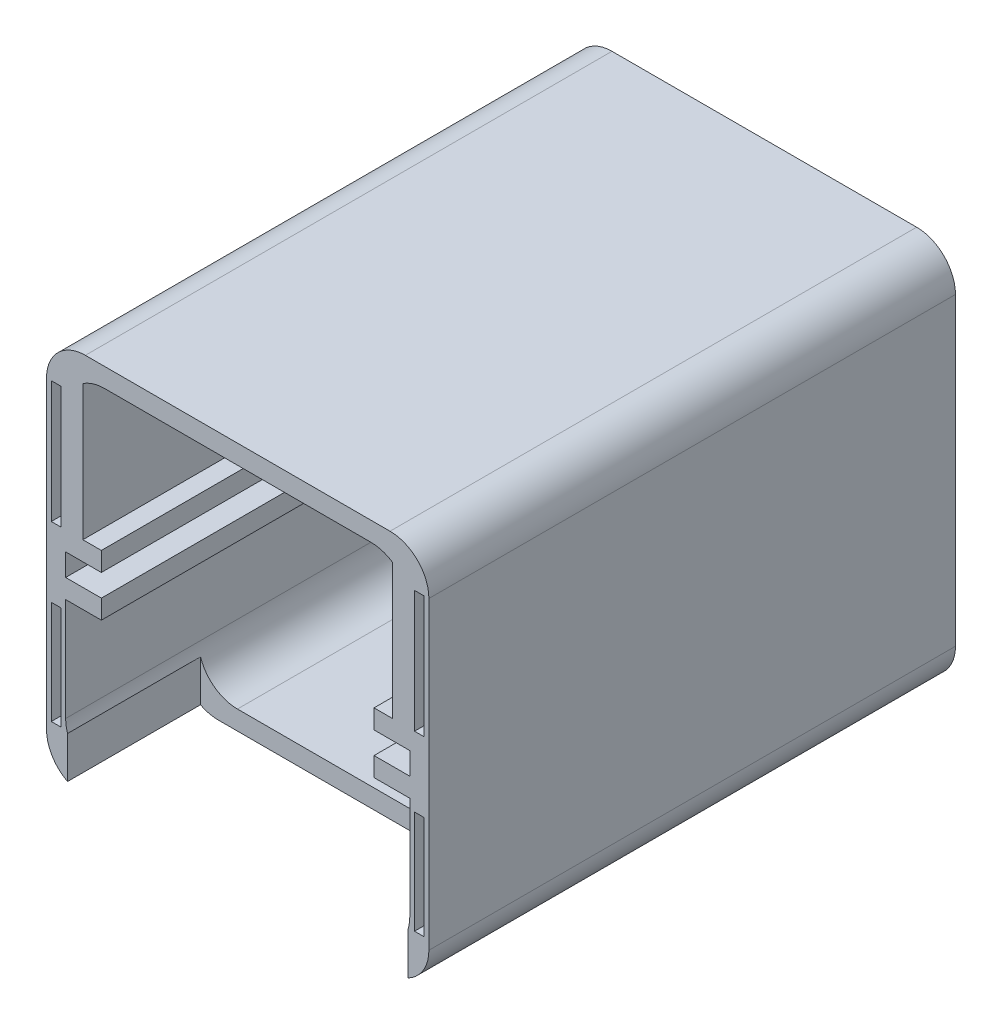
from build123d import *

# Parameters (mm, degrees)
SKETCH1_W                = 100
SKETCH1_H                = 100
BOSS_EXTRUDE1_DEPTH      = 250
SKETCH2_W                = 90
SKETCH2_H                = 90
CUT_EXTRUDE1_DEPTH       = 288.228132327
FILLET1_R                = 10.16
SKETCH3_W                = 9.3412
SKETCH3_H                = 5
BOSS_EXTRUDE2_DEPTH      = 250
SKETCH4_W                = 100
SKETCH4_H                = 125
CUT_EXTRUDE2_DEPTH       = 288.228132327
SKETCH6_W                = 90
SKETCH6_H                = 5.08
BOSS_EXTRUDE3_DEPTH      = 95
SKETCH7_R                = 45.3
CUT_EXTRUDE4_DEPTH       = 5.08
SKETCH10_R               = 48.300000047
BOSS_EXTRUDE4_DEPTH      = 30
SKETCH11_R               = 45.3
CUT_EXTRUDE5_DEPTH       = 30
SKETCH13_W               = 63.5
SKETCH13_H               = 63.5
CUT_EXTRUDE7_DEPTH       = 5
FILLET4_R                = 1.27
FILLET5_R                = 10.16
BOSS_EXTRUDE6_DEPTH      = 30
SKETCH16_R               = 45.3
CUT_EXTRUDE8_DEPTH       = 189.745860882
CUT_EXTRUDE10_DEPTH      = 210.821352584
SKETCH19_W               = 81
SKETCH19_H               = 64.77
CUT_EXTRUDE11_DEPTH      = 25.4
SKETCH20_W               = 81
SKETCH20_H               = 32.5
BOSS_EXTRUDE7_DEPTH      = 5
BOSS_EXTRUDE8_START      = 32.5
BOSS_EXTRUDE8_DEPTH      = 32.5
BOSS_EXTRUDE10_DEPTH     = 119.92
SKETCH25_W               = 73.5
SKETCH25_H               = 16.413635584
BOSS_EXTRUDE11_DEPTH     = 6.35
SKETCH26_W               = 17.272
SKETCH26_H               = 100
CUT_EXTRUDE12_DEPTH      = 132
SKETCH28_W               = 81
SKETCH28_H               = 37.9
CUT_EXTRUDE13_DEPTH      = 113.57
SKETCH29_W               = 2.5
SKETCH29_H               = 31.9
SKETCH29_H_2             = 27
CUT_EXTRUDE14_DEPTH      = 40
CUT_EXTRUDE15_DEPTH      = 198.405678703
CUT_EXTRUDE15_DEPTH_BACK = 119.92
SKETCH30_W               = 90
SKETCH30_H               = 37.9
BOSS_EXTRUDE12_DEPTH     = 119.92
CUT_EXTRUDE16_REACH      = 289.228
SKETCH33_W               = 89
SKETCH33_H               = 34.77
SKETCH35_W               = 4.5
SKETCH35_H               = 38.1
BOSS_EXTRUDE14_DEPTH     = 119.92


with BuildPart() as part:
    # Sketch1 → Boss-Extrude1 (new body)
    with BuildSketch(Plane.XY):
        with Locations((50, 50)):
            Rectangle(SKETCH1_W, SKETCH1_H)
    extrude(amount=BOSS_EXTRUDE1_DEPTH)

    # Sketch2 → Cut-Extrude1 (cut, through all)
    with BuildSketch(Plane(origin=(0, 0, 0), x_dir=(-1, 0, 0), z_dir=(0, 0, -1))):
        with Locations((-50, 50)):
            Rectangle(SKETCH2_W, SKETCH2_H)
    extrude(amount=-CUT_EXTRUDE1_DEPTH, mode=Mode.SUBTRACT)

    # Fillet1
    fillet1_edges = [part.edges().sort_by_distance(p)[0] for p in [
        (0, 100, 125),
        (0, 0, 125),
        (100, 0, 125),
        (100, 100, 125),
    ]]
    fillet(fillet1_edges, radius=FILLET1_R)

    # Sketch3 → Boss-Extrude2 (add, through all)
    with BuildSketch(Plane(origin=(0, 0, 0), x_dir=(-1, 0, 0), z_dir=(0, 0, -1))):
        with Locations((-90.3294, 55.4)):
            Rectangle(SKETCH3_W, SKETCH3_H)
        with Locations((-90.3294, 44.6)):
            Rectangle(SKETCH3_W, SKETCH3_H)
        with Locations((-9.6706, 44.6)):
            Rectangle(SKETCH3_W, SKETCH3_H)
        with Locations((-9.6706, 55.4)):
            Rectangle(SKETCH3_W, SKETCH3_H)
    extrude(amount=-BOSS_EXTRUDE2_DEPTH)

    # Sketch4 → Cut-Extrude2 (cut, through all)
    with BuildSketch(Plane(origin=(0, 100, 0), x_dir=(1, 0, 0), z_dir=(0, 1, 0))):
        with Locations((50, -62.5)):
            Rectangle(SKETCH4_W, SKETCH4_H)
    extrude(amount=-CUT_EXTRUDE2_DEPTH, mode=Mode.SUBTRACT)

    # Sketch6 → Boss-Extrude3 (add)
    with BuildSketch(Plane(origin=(0, 5, 0), x_dir=(1, 0, 0), z_dir=(0, 1, 0))):
        with Locations((50, -127.54)):
            Rectangle(SKETCH6_W, SKETCH6_H)
    extrude(amount=BOSS_EXTRUDE3_DEPTH)

    # Sketch7 → Cut-Extrude4 (cut)
    with BuildSketch(Plane(origin=(0, 0, 125), x_dir=(-1, 0, 0), z_dir=(0, 0, -1))):
        with Locations((-50, 50)):
            Circle(SKETCH7_R)
    extrude(amount=-CUT_EXTRUDE4_DEPTH, mode=Mode.SUBTRACT)

    # Sketch10 → Boss-Extrude4 (add)
    with BuildSketch(Plane(origin=(0, 0, 125), x_dir=(-1, 0, 0), z_dir=(0, 0, -1))):
        with Locations(Location((-50, 50, 0), (0, 0, 180))):
            Circle(SKETCH10_R)
    extrude(amount=BOSS_EXTRUDE4_DEPTH)

    # Sketch11 → Cut-Extrude5 (cut)
    with BuildSketch(Plane(origin=(0, 0, 95), x_dir=(-1, 0, 0), z_dir=(0, 0, -1))):
        with Locations((-50, 50)):
            Circle(SKETCH11_R)
    extrude(amount=-CUT_EXTRUDE5_DEPTH, mode=Mode.SUBTRACT)

    # Sketch13 → Cut-Extrude7 (cut)
    with BuildSketch(Plane.XZ):
        with Locations((50, 218.25)):
            Rectangle(SKETCH13_W, SKETCH13_H)
    extrude(amount=-CUT_EXTRUDE7_DEPTH, mode=Mode.SUBTRACT)

    # Fillet4
    fillet4_edges = [part.edges().sort_by_distance(p)[0] for p in [
        (81.75, 0, 218.25),
        (18.25, 0, 218.25),
        (50, 0, 186.5),
    ]]
    fillet(fillet4_edges, radius=FILLET4_R)

    # Fillet5
    fillet5_edges = [part.edges().sort_by_distance(p)[0] for p in [
        (95, 95, 190.04),
        (5, 95, 190.04),
        (5, 5, 190.04),
        (95, 5, 190.04),
    ]]
    fillet(fillet5_edges, radius=FILLET5_R)

    # Sketch14 → Boss-Extrude6 (add)
    with BuildSketch(Plane(origin=(0, 0, 125), x_dir=(-1, 0, 0), z_dir=(0, 0, -1))):
        with BuildLine():
            Line((-5, 100), (-95, 100))
            Line((-95, 100), (-95, 98.592142595))
            ThreePointArc((-95, 98.592142595), (-98.661881885, 94.879841267), (-100, 89.84))
            Line((-100, 89.84), (-100, 10.16))
            ThreePointArc((-100, 10.16), (-97.024204897, 2.975795103), (-89.84, 0))
            Line((-89.84, 0), (-10.16, 0))
            ThreePointArc((-10.16, 0), (-2.975795103, 2.975795103), (0, 10.16))
            Line((0, 10.16), (0, 89.84))
            ThreePointArc((0, 89.84), (-1.338118115, 94.879841267), (-5, 98.592142595))
            Line((-5, 98.592142595), (-5, 100))
        make_face()
    extrude(amount=BOSS_EXTRUDE6_DEPTH)

    # Sketch16 → Cut-Extrude8 (cut, through all)
    with BuildSketch(Plane.XY.offset(125)):
        with Locations(Location((50, 50, 0), (0, 0, 169.956667322))):
            Circle(SKETCH16_R)
    extrude(amount=-CUT_EXTRUDE8_DEPTH, mode=Mode.SUBTRACT)

    # Sketch18 → Cut-Extrude10 (cut, through all)
    with BuildSketch(Plane(origin=(0, 0, 95), x_dir=(-1, 0, 0), z_dir=(0, 0, -1))):
        with BuildLine():
            Line((-100, 89.84), (-100, 107.62))
            Line((-100, 107.62), (0, 107.62))
            Line((0, 107.62), (0, 89.84))
            ThreePointArc((0, 89.84), (-2.975795103, 97.024204897), (-10.16, 100))
            Line((-10.16, 100), (-89.84, 100))
            ThreePointArc((-89.84, 100), (-97.024204897, 97.024204897), (-100, 89.84))
        make_face()
    extrude(amount=-CUT_EXTRUDE10_DEPTH, mode=Mode.SUBTRACT)

    # Sketch19 → Cut-Extrude11 (cut)
    with BuildSketch(Plane.XZ):
        with Locations((50, 217.615)):
            Rectangle(SKETCH19_W, SKETCH19_H)
    extrude(amount=-CUT_EXTRUDE11_DEPTH, mode=Mode.SUBTRACT)

    # Sketch20 → Boss-Extrude7 (add)
    with BuildSketch(Plane.XZ):
        with Locations((50, 201.48)):
            Rectangle(SKETCH20_W, SKETCH20_H)
    extrude(amount=-BOSS_EXTRUDE7_DEPTH)

    # Sketch21 → Boss-Extrude8 (add)
    with BuildSketch(Plane.XY.offset(185.23).offset(BOSS_EXTRUDE8_START)):
        with BuildLine():
            Line((9.5, 5), (15.16, 5))
            ThreePointArc((15.16, 5), (12.201837845, 5.440181243), (9.5, 6.722583334))
            Line((9.5, 6.722583334), (9.5, 5))
        make_face()
        with BuildLine():
            ThreePointArc((90.5, 6.722583334), (87.798162155, 5.440181243), (84.84, 5))
            Line((84.84, 5), (90.5, 5))
            Line((90.5, 5), (90.5, 6.722583334))
        make_face()
    extrude(amount=-BOSS_EXTRUDE8_DEPTH)

    # Sketch24 → Boss-Extrude10 (add)
    with BuildSketch(Plane.XY.offset(130.08)):
        Polygon((95, 57.9), (86.75, 57.9), (86.75, 92.9), (13.25, 92.9), (13.25, 57.9), (5, 57.9), (5, 95), (95, 95), align=None)
    extrude(amount=BOSS_EXTRUDE10_DEPTH)

    # Sketch25 → Boss-Extrude11 (add)
    with BuildSketch(Plane.XY.offset(130.08)):
        with Locations((50, 84.693182208)):
            Rectangle(SKETCH25_W, SKETCH25_H)
    extrude(amount=BOSS_EXTRUDE11_DEPTH)

    # Sketch26 → Cut-Extrude12 (cut)
    with BuildSketch(Plane.ZY):
        with Locations((103.636, 50)):
            Rectangle(SKETCH26_W, SKETCH26_H)
    extrude(amount=-CUT_EXTRUDE12_DEPTH, mode=Mode.SUBTRACT)

    # Sketch28 → Cut-Extrude13 (cut)
    with BuildSketch(Plane.XY.offset(250)):
        with Locations((50, 76.85)):
            Rectangle(SKETCH28_W, SKETCH28_H)
    extrude(amount=-CUT_EXTRUDE13_DEPTH, mode=Mode.SUBTRACT)

    # Sketch29 → Cut-Extrude14 (cut)
    with BuildSketch(Plane.XY.offset(250)):
        with Locations((2.5, 73.85)):
            Rectangle(SKETCH29_W, SKETCH29_H)
        with Locations((2.5, 26.1)):
            Rectangle(SKETCH29_W, SKETCH29_H_2)
        with Locations((97.5, 26.1)):
            Rectangle(SKETCH29_W, SKETCH29_H_2)
        with Locations((97.5, 73.85)):
            Rectangle(SKETCH29_W, SKETCH29_H)
    extrude(amount=-CUT_EXTRUDE14_DEPTH, mode=Mode.SUBTRACT)

    # Sketch30 → Cut-Extrude15 (cut, two sides: drawn at the far end of the back side and taken through both)
    with BuildSketch(Plane.XY.offset(250).offset(-CUT_EXTRUDE15_DEPTH_BACK)):
        with Locations((50, 76.85)):
            Rectangle(SKETCH30_W, SKETCH30_H)
    extrude(amount=CUT_EXTRUDE15_DEPTH + CUT_EXTRUDE15_DEPTH_BACK, mode=Mode.SUBTRACT)

    # Sketch32 → Boss-Extrude12 (add)
    with BuildSketch(Plane.XY.offset(130.08)):
        with BuildLine():
            Line((15.16, 95), (84.84, 95))
            ThreePointArc((84.84, 95), (92.024204897, 92.024204897), (95, 84.84))
            Line((95, 84.84), (95, 95.8))
            Line((95, 95.8), (5, 95.8))
            Line((5, 95.8), (5, 84.84))
            ThreePointArc((5, 84.84), (7.975795103, 92.024204897), (15.16, 95))
        make_face()
    extrude(amount=BOSS_EXTRUDE12_DEPTH)

    # Cut-Extrude16: up to this face of the body (flat: up to its plane)
    cut_extrude16_end = Plane(part.part.faces().sort_by_distance((9.6706, 42.1, 190.04))[0])
    # Sketch33 → Cut-Extrude16 (cut, up to the picked face)
    with BuildSketch(Plane.XZ, mode=Mode.PRIVATE) as cut_extrude16_sk1:
        with Locations((50, 232.615)):
            Rectangle(SKETCH33_W, SKETCH33_H)
    cut_extrude16_tool1 = split(extrude(cut_extrude16_sk1.sketch, amount=-CUT_EXTRUDE16_REACH, mode=Mode.PRIVATE), bisect_by=cut_extrude16_end, keep=Keep.BOTH, mode=Mode.PRIVATE)
    add(cut_extrude16_tool1.solids().sort_by(Axis((50, 0, 232.615), (0, 1, 0)))[0], mode=Mode.SUBTRACT)

    # Sketch35 → Boss-Extrude14 (add)
    with BuildSketch(Plane.XY.offset(250)):
        with Locations((7.25, 76.95)):
            Rectangle(SKETCH35_W, SKETCH35_H)
        with Locations((92.75, 76.95)):
            Rectangle(SKETCH35_W, SKETCH35_H)
    extrude(amount=-BOSS_EXTRUDE14_DEPTH)


solid = part.part
